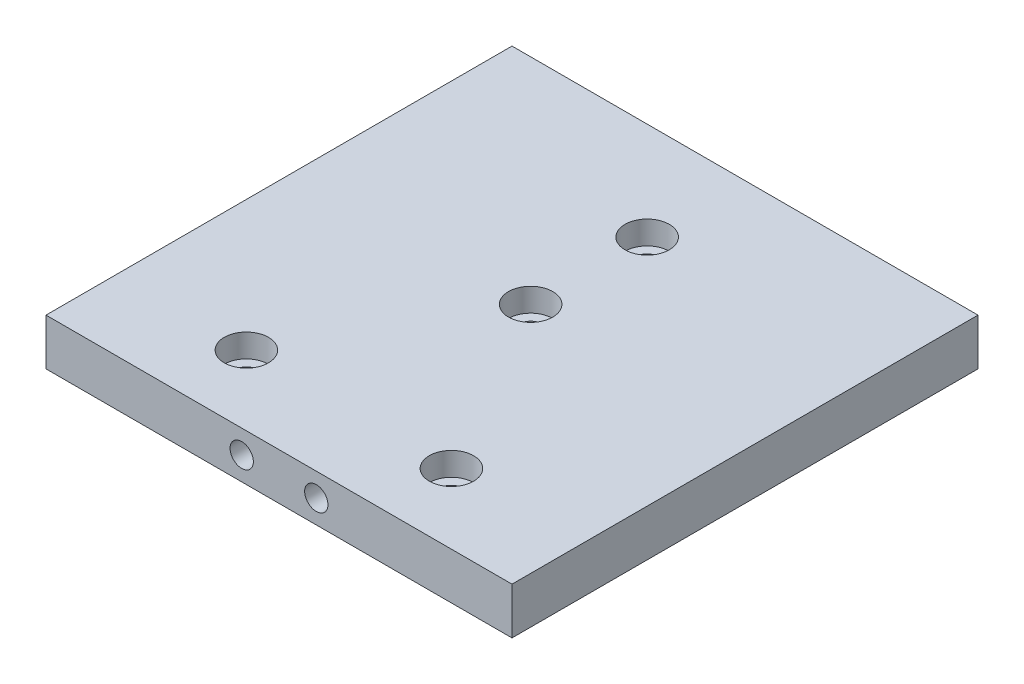
from build123d import *

# Parameters (mm, degrees)
SKETCH_1_W          = 100
SKETCH_1_H          = 100
EXTRUDE_1_DEPTH     = 10
SKETCH_3_R          = 2.5
CUT_EXTRUDE_1_DEPTH = 10
SKETCH_3_3_R        = 1.5
CUT_EXTRUDE_2_DEPTH = 70
SKETCH_3_4_R        = 1.5
CUT_EXTRUDE_3_DEPTH = 70
SKETCH_3_7_R        = 2.5
CUT_EXTRUDE_4_DEPTH = 10
SKETCH_4_R          = 1
CUT_EXTRUDE_5_DEPTH = 5
SKETCH_2_R          = 2.65
CUT_EXTRUDE_6_DEPTH = 10
SKETCH_2_3_R        = 4.75
SKETCH_2_3_R_2      = 2.65
CUT_EXTRUDE_7_DEPTH = 5


with BuildPart() as part:
    # 스케치1 → 보스-돌출1 (new body)
    with BuildSketch(Plane(origin=(0, 0, 0), x_dir=(1, 0, 0), z_dir=(0, 1, 0))):
        Rectangle(SKETCH_1_W, SKETCH_1_H)
    extrude(amount=EXTRUDE_1_DEPTH)

    # 스케치3 → 컷-돌출1 (cut)
    with BuildSketch(Plane.XY.offset(50)):
        with Locations((-8, 5)):
            Circle(SKETCH_3_R)
    extrude(amount=-CUT_EXTRUDE_1_DEPTH, mode=Mode.SUBTRACT)

    # 스케치3<3> → 컷-돌출2 (cut)
    with BuildSketch(Plane.XY.offset(50)):
        with Locations((-8, 5)):
            Circle(SKETCH_3_3_R)
    extrude(amount=-CUT_EXTRUDE_2_DEPTH, mode=Mode.SUBTRACT)

    # 스케치3<4> → 컷-돌출3 (cut)
    with BuildSketch(Plane.XY.offset(50)):
        with Locations((8, 5)):
            Circle(SKETCH_3_4_R)
    extrude(amount=-CUT_EXTRUDE_3_DEPTH, mode=Mode.SUBTRACT)

    # 스케치3<7> → 컷-돌출4 (cut)
    with BuildSketch(Plane.XY.offset(50)):
        with Locations((8, 5)):
            Circle(SKETCH_3_7_R)
    extrude(amount=-CUT_EXTRUDE_4_DEPTH, mode=Mode.SUBTRACT)

    # 스케치4 → 컷-돌출5 (cut)
    with BuildSketch(Plane.XZ):
        with Locations((-8.000069435, 35)):
            Circle(SKETCH_4_R)
        with Locations((8, 35)):
            Circle(SKETCH_4_R)
        with Locations((8, -16.5)):
            Circle(SKETCH_4_R)
        with Locations((-8.000069435, -16.5)):
            Circle(SKETCH_4_R)
    extrude(amount=-CUT_EXTRUDE_5_DEPTH, mode=Mode.SUBTRACT)

    # 스케치2 → 컷-돌출6 (cut)
    with BuildSketch(Plane(origin=(0, 10, 0), x_dir=(1, 0, 0), z_dir=(0, 1, 0))):
        with Locations((0, 29)):
            Circle(SKETCH_2_R)
        with Locations((0, 4)):
            Circle(SKETCH_2_R)
        with Locations((-22, -35)):
            Circle(SKETCH_2_R)
        with Locations((22, -35)):
            Circle(SKETCH_2_R)
    extrude(amount=-CUT_EXTRUDE_6_DEPTH, mode=Mode.SUBTRACT)

    # 스케치2<3> → 컷-돌출7 (cut)
    # profile 1 of 4: a face of its own
    with BuildSketch(Plane(origin=(0, 10, 0), x_dir=(1, 0, 0), z_dir=(0, 1, 0))):
        with Locations((0, 29)):
            Circle(SKETCH_2_3_R)
        with Locations((0, 29)):
            Circle(SKETCH_2_3_R_2, mode=Mode.SUBTRACT)
    # profile 2 of 4: a face of its own
    with BuildSketch(Plane(origin=(0, 10, 0), x_dir=(1, 0, 0), z_dir=(0, 1, 0))):
        with Locations((0, 4)):
            Circle(SKETCH_2_3_R)
        with Locations((0, 4)):
            Circle(SKETCH_2_3_R_2, mode=Mode.SUBTRACT)
    # profile 3 of 4: a face of its own
    with BuildSketch(Plane(origin=(0, 10, 0), x_dir=(1, 0, 0), z_dir=(0, 1, 0))):
        with Locations((-22, -35)):
            Circle(SKETCH_2_3_R)
        with Locations((-22, -35)):
            Circle(SKETCH_2_3_R_2, mode=Mode.SUBTRACT)
    # profile 4 of 4: a face of its own
    with BuildSketch(Plane(origin=(0, 10, 0), x_dir=(1, 0, 0), z_dir=(0, 1, 0))):
        with Locations((22, -35)):
            Circle(SKETCH_2_3_R)
        with Locations((22, -35)):
            Circle(SKETCH_2_3_R_2, mode=Mode.SUBTRACT)
    extrude(amount=-CUT_EXTRUDE_7_DEPTH, mode=Mode.SUBTRACT)


solid = part.part
